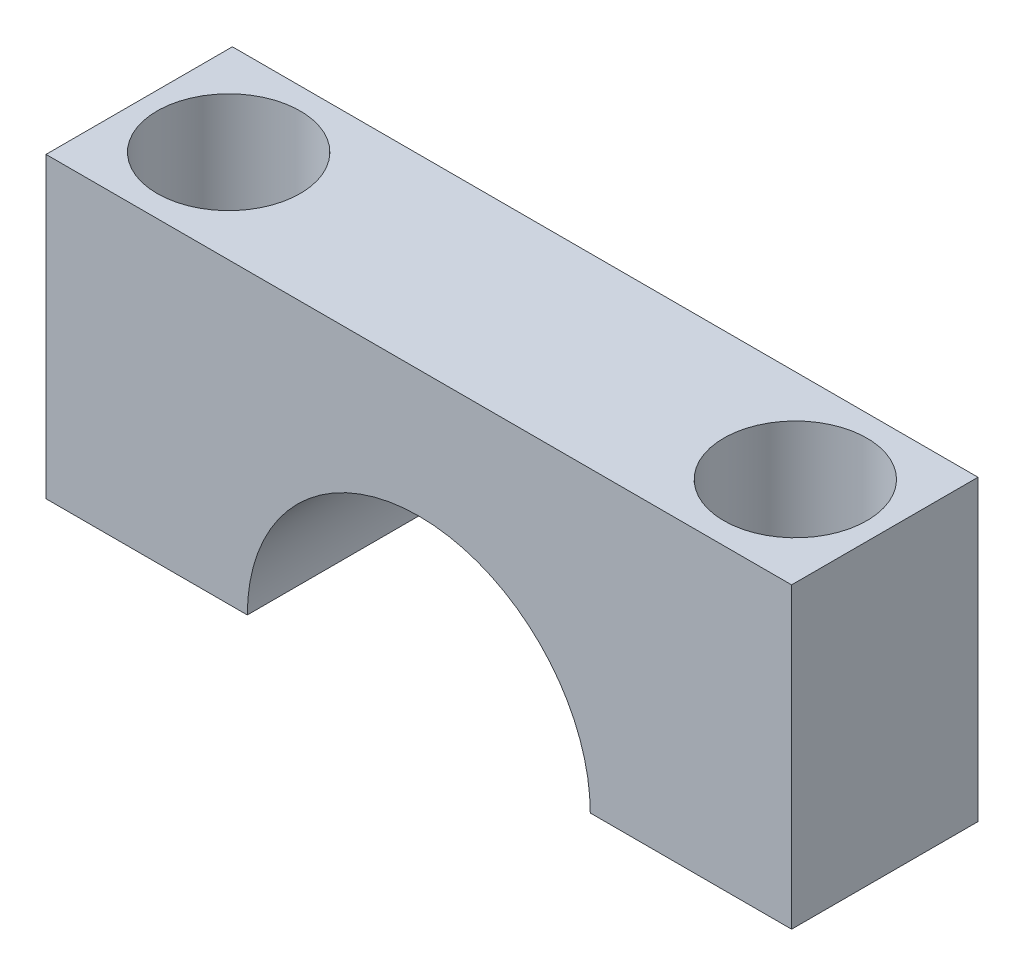
from build123d import *

# Parameters (mm, degrees)
BOSS_EXTRUDE1_DEPTH   = 3.175
F_2_CLEARANCE_HOLE1_D = 2.4384


with BuildPart() as part:
    # Sketch1 → Boss-Extrude1 (new body)
    with BuildSketch(Plane.XY):
        with BuildLine():
            Line((3.429, 0), (0, 0))
            Line((0, 0), (0, 5.08))
            Line((0, 5.08), (12.7, 5.08))
            Line((12.7, 5.08), (12.7, 0))
            Line((12.7, 0), (9.271, 0))
            ThreePointArc((9.271, 0), (6.35, 2.921), (3.429, 0))
        make_face()
    extrude(amount=BOSS_EXTRUDE1_DEPTH)

    # #2 Clearance Hole1 (through all)
    with Locations(Plane(origin=(1.524, 5.08, 1.5875), x_dir=(1, 0, 0), z_dir=(0, 1, 0))):
        with Locations((0, 0), (9.652, 0)):
            Hole(F_2_CLEARANCE_HOLE1_D / 2)


solid = part.part
